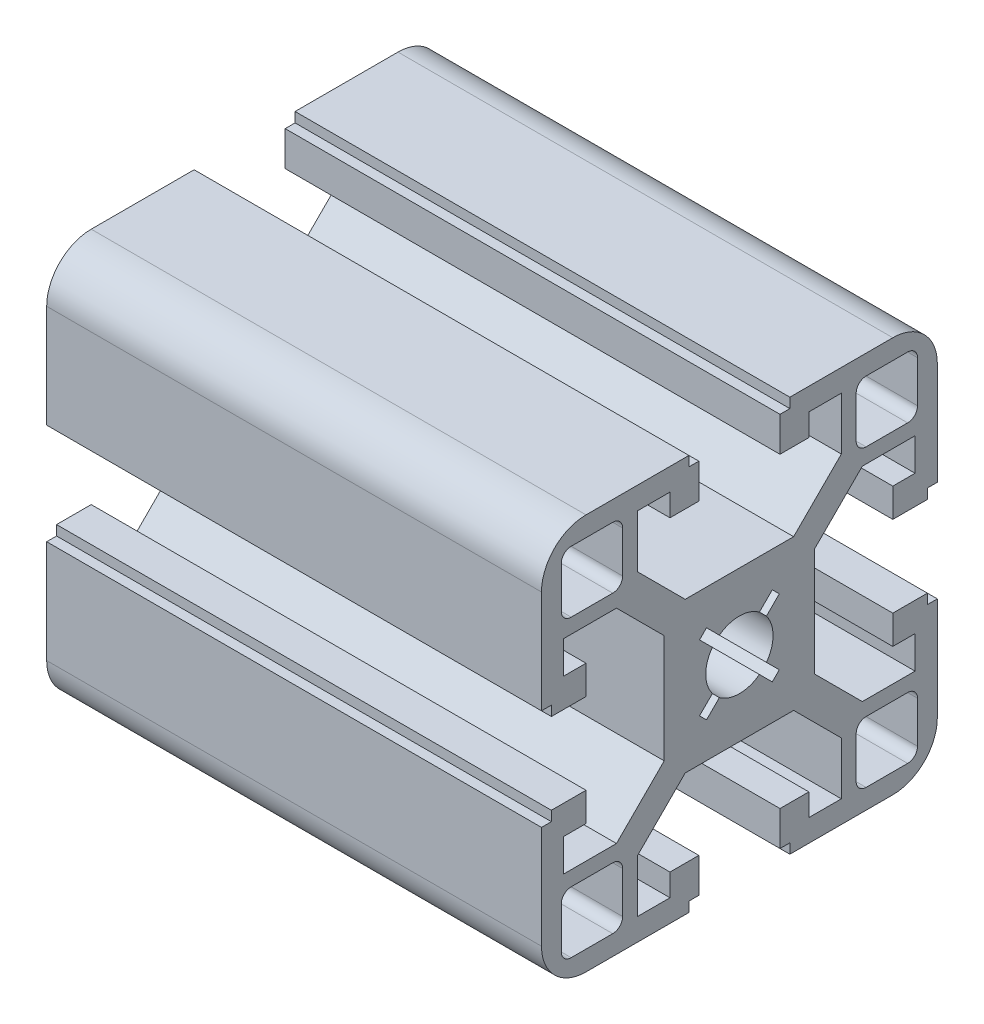
from build123d import *

# Parameters (mm, degrees)
EXTRUDE_1_DEPTH = 50


with BuildPart() as part:
    # 草图1 → 凸台-拉伸1 (new body)
    with BuildSketch(Plane(origin=(0, 0, 0), x_dir=(0, 0, -1), z_dir=(1, 0, 0))):
        with BuildLine():
            Line((4.82004008, 19.27995992), (3.82004008, 19.27995992))
            Line((3.82004008, 19.27995992), (3.82004008, 15.77995992))
            Line((3.82004008, 15.77995992), (6.73639159, 15.77995992))
            Line((6.73639159, 15.77995992), (6.73639159, 18.02995992))
            Line((6.73639159, 18.02995992), (10.02004008, 18.02995992))
            Line((10.02004008, 18.02995992), (10.02004008, 12.70128026))
            Line((10.02004008, 12.70128026), (5.19871974, 7.87995992))
            Line((5.19871974, 7.87995992), (-5.75863958, 7.87995992))
            Line((-5.75863958, 7.87995992), (-10.57995992, 12.70128026))
            Line((-10.57995992, 12.70128026), (-10.57995992, 18.02995992))
            Line((-10.57995992, 18.02995992), (-7.29631143, 18.02995992))
            Line((-7.29631143, 18.02995992), (-7.29631143, 15.77995992))
            Line((-7.29631143, 15.77995992), (-4.37995992, 15.77995992))
            Line((-4.37995992, 15.77995992), (-4.37995992, 19.27995992))
            Line((-4.37995992, 19.27995992), (-5.37995992, 19.27995992))
            Line((-5.37995992, 19.27995992), (-5.37995992, 20.27995992))
            Line((-5.37995992, 20.27995992), (-15.77995992, 20.27995992))
            ThreePointArc((-15.77995992, 20.27995992), (-18.961940435, 18.961940435), (-20.27995992, 15.77995992))
            Line((-20.27995992, 15.77995992), (-20.27995992, 5.37995992))
            Line((-20.27995992, 5.37995992), (-19.27995992, 5.37995992))
            Line((-19.27995992, 5.37995992), (-19.27995992, 4.37995992))
            Line((-19.27995992, 4.37995992), (-15.77995992, 4.37995992))
            Line((-15.77995992, 4.37995992), (-15.77995992, 7.29631143))
            Line((-15.77995992, 7.29631143), (-18.02995992, 7.29631143))
            Line((-18.02995992, 7.29631143), (-18.02995992, 10.57995992))
            Line((-18.02995992, 10.57995992), (-12.70128026, 10.57995992))
            Line((-12.70128026, 10.57995992), (-7.87995992, 5.75863958))
            Line((-7.87995992, 5.75863958), (-7.87995992, -5.19871974))
            Line((-7.87995992, -5.19871974), (-12.70128026, -10.02004008))
            Line((-12.70128026, -10.02004008), (-18.02995992, -10.02004008))
            Line((-18.02995992, -10.02004008), (-18.02995992, -6.73639159))
            Line((-18.02995992, -6.73639159), (-15.77995992, -6.73639159))
            Line((-15.77995992, -6.73639159), (-15.77995992, -3.82004008))
            Line((-15.77995992, -3.82004008), (-19.27995992, -3.82004008))
            Line((-19.27995992, -3.82004008), (-19.27995992, -4.82004008))
            Line((-19.27995992, -4.82004008), (-20.27995992, -4.82004008))
            Line((-20.27995992, -4.82004008), (-20.27995992, -15.22004008))
            ThreePointArc((-20.27995992, -15.22004008), (-18.961940435, -18.402020595), (-15.77995992, -19.72004008))
            Line((-15.77995992, -19.72004008), (-5.37995992, -19.72004008))
            Line((-5.37995992, -19.72004008), (-5.37995992, -18.72004008))
            Line((-5.37995992, -18.72004008), (-4.37995992, -18.72004008))
            Line((-4.37995992, -18.72004008), (-4.37995992, -15.22004008))
            Line((-4.37995992, -15.22004008), (-7.29631143, -15.22004008))
            Line((-7.29631143, -15.22004008), (-7.29631143, -17.47004008))
            Line((-7.29631143, -17.47004008), (-10.57995992, -17.47004008))
            Line((-10.57995992, -17.47004008), (-10.57995992, -12.14136042))
            Line((-10.57995992, -12.14136042), (-5.75863958, -7.32004008))
            Line((-5.75863958, -7.32004008), (5.19871974, -7.32004008))
            Line((5.19871974, -7.32004008), (10.02004008, -12.14136042))
            Line((10.02004008, -12.14136042), (10.02004008, -17.47004008))
            Line((10.02004008, -17.47004008), (6.73639159, -17.47004008))
            Line((6.73639159, -17.47004008), (6.73639159, -15.22004008))
            Line((6.73639159, -15.22004008), (3.82004008, -15.22004008))
            Line((3.82004008, -15.22004008), (3.82004008, -18.72004008))
            Line((3.82004008, -18.72004008), (4.82004008, -18.72004008))
            Line((4.82004008, -18.72004008), (4.82004008, -19.72004008))
            Line((4.82004008, -19.72004008), (15.22004008, -19.72004008))
            ThreePointArc((15.22004008, -19.72004008), (18.402020595, -18.402020595), (19.72004008, -15.22004008))
            Line((19.72004008, -15.22004008), (19.72004008, -4.82004008))
            Line((19.72004008, -4.82004008), (18.72004008, -4.82004008))
            Line((18.72004008, -4.82004008), (18.72004008, -3.82004008))
            Line((18.72004008, -3.82004008), (15.22004008, -3.82004008))
            Line((15.22004008, -3.82004008), (15.22004008, -6.73639159))
            Line((15.22004008, -6.73639159), (17.47004008, -6.73639159))
            Line((17.47004008, -6.73639159), (17.47004008, -10.02004008))
            Line((17.47004008, -10.02004008), (12.14136042, -10.02004008))
            Line((12.14136042, -10.02004008), (7.32004008, -5.19871974))
            Line((7.32004008, -5.19871974), (7.32004008, 5.75863958))
            Line((7.32004008, 5.75863958), (12.14136042, 10.57995992))
            Line((12.14136042, 10.57995992), (17.47004008, 10.57995992))
            Line((17.47004008, 10.57995992), (17.47004008, 7.29631143))
            Line((17.47004008, 7.29631143), (15.22004008, 7.29631143))
            Line((15.22004008, 7.29631143), (15.22004008, 4.37995992))
            Line((15.22004008, 4.37995992), (18.72004008, 4.37995992))
            Line((18.72004008, 4.37995992), (18.72004008, 5.37995992))
            Line((18.72004008, 5.37995992), (19.72004008, 5.37995992))
            Line((19.72004008, 5.37995992), (19.72004008, 15.77995992))
            ThreePointArc((19.72004008, 15.77995992), (18.402020595, 18.961940435), (15.22004008, 20.27995992))
            Line((15.22004008, 20.27995992), (4.82004008, 20.27995992))
            Line((4.82004008, 20.27995992), (4.82004008, 19.27995992))
        make_face()
        with BuildLine():
            Line((-13.07995992, -17.72004008), (-17.27995992, -17.72004008))
            ThreePointArc((-17.27995992, -17.72004008), (-17.987066701, -17.427146861), (-18.27995992, -16.72004008))
            Line((-18.27995992, -16.72004008), (-18.27995992, -12.52004008))
            ThreePointArc((-18.27995992, -12.52004008), (-17.987066701, -11.812933299), (-17.27995992, -11.52004008))
            Line((-17.27995992, -11.52004008), (-13.07995992, -11.52004008))
            ThreePointArc((-13.07995992, -11.52004008), (-12.372853139, -11.812933299), (-12.07995992, -12.52004008))
            Line((-12.07995992, -12.52004008), (-12.07995992, -16.72004008))
            ThreePointArc((-12.07995992, -16.72004008), (-12.372853139, -17.427146861), (-13.07995992, -17.72004008))
        make_face(mode=Mode.SUBTRACT)
        with BuildLine():
            Line((-17.27995992, 18.27995992), (-13.07995992, 18.27995992))
            ThreePointArc((-13.07995992, 18.27995992), (-12.372853139, 17.987066701), (-12.07995992, 17.27995992))
            Line((-12.07995992, 17.27995992), (-12.07995992, 13.07995992))
            ThreePointArc((-12.07995992, 13.07995992), (-12.372853139, 12.372853139), (-13.07995992, 12.07995992))
            Line((-13.07995992, 12.07995992), (-17.27995992, 12.07995992))
            ThreePointArc((-17.27995992, 12.07995992), (-17.987066701, 12.372853139), (-18.27995992, 13.07995992))
            Line((-18.27995992, 13.07995992), (-18.27995992, 17.27995992))
            ThreePointArc((-18.27995992, 17.27995992), (-17.987066701, 17.987066701), (-17.27995992, 18.27995992))
        make_face(mode=Mode.SUBTRACT)
        with BuildLine():
            Line((16.72004008, 12.07995992), (12.52004008, 12.07995992))
            ThreePointArc((12.52004008, 12.07995992), (11.812933299, 12.372853139), (11.52004008, 13.07995992))
            Line((11.52004008, 13.07995992), (11.52004008, 17.27995992))
            ThreePointArc((11.52004008, 17.27995992), (11.812933299, 17.987066701), (12.52004008, 18.27995992))
            Line((12.52004008, 18.27995992), (16.72004008, 18.27995992))
            ThreePointArc((16.72004008, 18.27995992), (17.427146861, 17.987066701), (17.72004008, 17.27995992))
            Line((17.72004008, 17.27995992), (17.72004008, 13.07995992))
            ThreePointArc((17.72004008, 13.07995992), (17.427146861, 12.372853139), (16.72004008, 12.07995992))
        make_face(mode=Mode.SUBTRACT)
        with BuildLine():
            Line((3.75045895, -3.04335217), (3.04335217, -3.75045895))
            Line((3.04335217, -3.75045895), (1.74451108, -2.45161786))
            ThreePointArc((1.74451108, -2.45161786), (-0.27995992, -3.12004008), (-2.30443092, -2.45161786))
            Line((-2.30443092, -2.45161786), (-3.60327201, -3.75045895))
            Line((-3.60327201, -3.75045895), (-4.31037879, -3.04335217))
            Line((-4.31037879, -3.04335217), (-3.0115377, -1.74451108))
            ThreePointArc((-3.0115377, -1.74451108), (-3.67995992, 0.27995992), (-3.0115377, 2.30443092))
            Line((-3.0115377, 2.30443092), (-4.31037879, 3.60327201))
            Line((-4.31037879, 3.60327201), (-3.60327201, 4.31037879))
            Line((-3.60327201, 4.31037879), (-2.30443092, 3.0115377))
            ThreePointArc((-2.30443092, 3.0115377), (-0.27995992, 3.67995992), (1.74451108, 3.0115377))
            Line((1.74451108, 3.0115377), (3.04335217, 4.31037879))
            Line((3.04335217, 4.31037879), (3.75045895, 3.60327201))
            Line((3.75045895, 3.60327201), (2.45161786, 2.30443092))
            ThreePointArc((2.45161786, 2.30443092), (3.12004008, 0.27995992), (2.45161786, -1.74451108))
            Line((2.45161786, -1.74451108), (3.75045895, -3.04335217))
        make_face(mode=Mode.SUBTRACT)
        with BuildLine():
            Line((17.72004008, -12.52004008), (17.72004008, -16.72004008))
            ThreePointArc((17.72004008, -16.72004008), (17.427146861, -17.427146861), (16.72004008, -17.72004008))
            Line((16.72004008, -17.72004008), (12.52004008, -17.72004008))
            ThreePointArc((12.52004008, -17.72004008), (11.812933299, -17.427146861), (11.52004008, -16.72004008))
            Line((11.52004008, -16.72004008), (11.52004008, -12.52004008))
            ThreePointArc((11.52004008, -12.52004008), (11.812933299, -11.812933299), (12.52004008, -11.52004008))
            Line((12.52004008, -11.52004008), (16.72004008, -11.52004008))
            ThreePointArc((16.72004008, -11.52004008), (17.427146861, -11.812933299), (17.72004008, -12.52004008))
        make_face(mode=Mode.SUBTRACT)
    extrude(amount=-EXTRUDE_1_DEPTH)


solid = part.part
